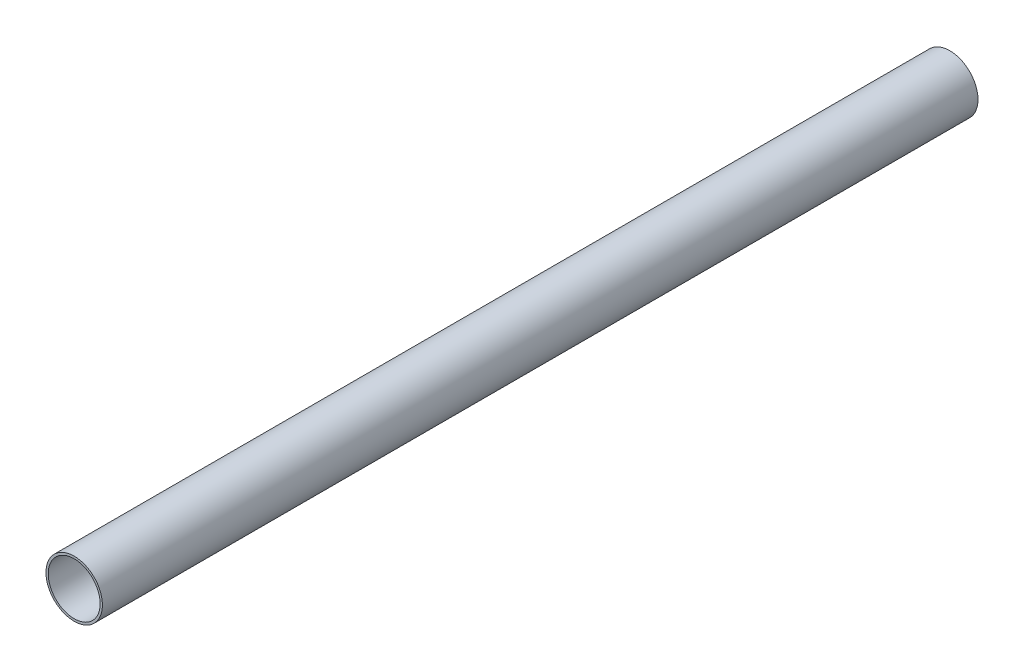
from build123d import *

# Parameters (mm, degrees)
SKETCH1_R           = 12.5
SKETCH1_R_2         = 11.5
BOSS_EXTRUDE1_DEPTH = 387.62


with BuildPart() as part:
    # Sketch1 → Boss-Extrude1 (new body)
    with BuildSketch(Plane.XY):
        Circle(SKETCH1_R)
        Circle(SKETCH1_R_2, mode=Mode.SUBTRACT)
    extrude(amount=BOSS_EXTRUDE1_DEPTH)


solid = part.part
